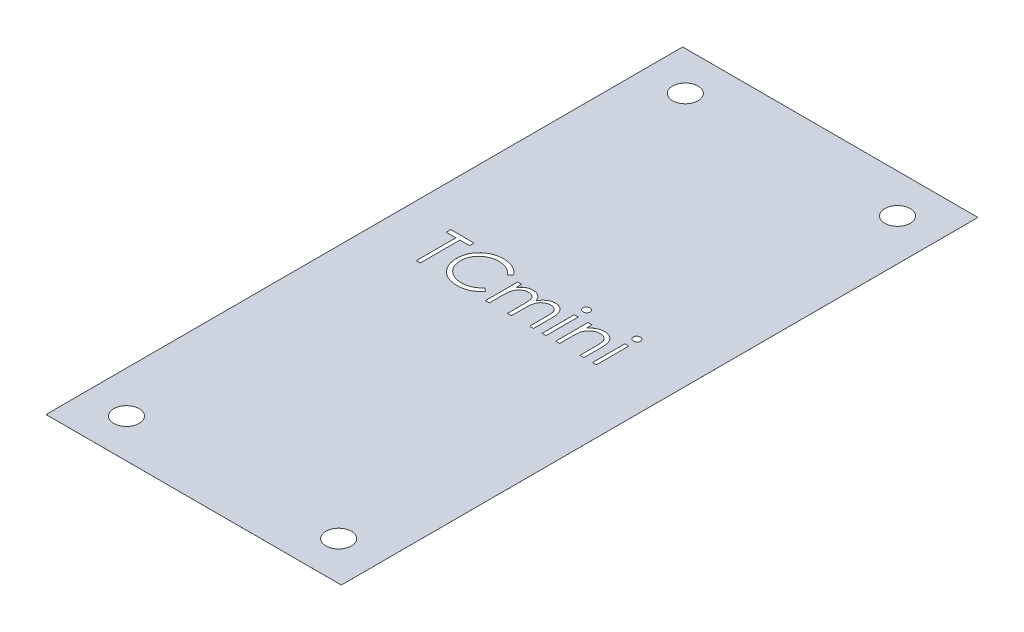
from build123d import *

# Parameters (mm, degrees)
SKETCH2_W           = 42.418
SKETCH2_H           = 91.44
BOSS_EXTRUDE1_DEPTH = 0.00254
SKETCH3_R           = 1.8288
CUT_EXTRUDE1_DEPTH  = 51.399802454
SKETCH5_W           = 0.569871795
SKETCH5_H           = 4.640384615
CUT_EXTRUDE2_DEPTH  = 2.54


with BuildPart() as part:
    # Sketch2 → Boss-Extrude1 (new body)
    with BuildSketch(Plane(origin=(0, 0, 0), x_dir=(1, 0, 0), z_dir=(0, 1, 0))):
        Rectangle(SKETCH2_W, SKETCH2_H)
    extrude(amount=BOSS_EXTRUDE1_DEPTH)

    # Sketch3 → Cut-Extrude1 (cut, through all)
    with BuildSketch(Plane(origin=(0, 0.00254, 0), x_dir=(1, 0, 0), z_dir=(0, 1, 0))):
        with Locations(Location((-15.24, 40.132, 0), (0, 0, 270))):
            Circle(SKETCH3_R)
        with Locations(Location((15.24, 40.132, 0), (0, 0, 270))):
            Circle(SKETCH3_R)
        with Locations(Location((15.24, -40.132, 0), (0, 0, 270))):
            Circle(SKETCH3_R)
        with Locations(Location((-15.24, -40.132, 0), (0, 0, 270))):
            Circle(SKETCH3_R)
    extrude(amount=-CUT_EXTRUDE1_DEPTH, mode=Mode.SUBTRACT)

    # Sketch5 → Cut-Extrude2 (cut)
    with BuildSketch(Plane(origin=(0, 0.00254, 0), x_dir=(1, 0, 0), z_dir=(0, 1, 0))):
        Polygon((-15.139819353, 5.698717949), (-15.139819353, 6.35), (-11.80199884, 6.35), (-11.80199884, 5.698717949), (-13.185973199, 5.698717949), (-13.185973199, 0), (-13.755844994, 0), (-13.755844994, 5.698717949), align=None)
        with BuildLine():
            Line((-4.963537302, 5.184815705), (-5.462175123, 4.803205128))
            add(Edge.make_bspline(
                [(-5.462175123, 4.803205128), (-5.497745806, 4.845597673), (-5.568407602, 4.929811221), (-5.682089298, 5.048065537), (-5.800565136, 5.158855368), (-5.923789827, 5.262708493), (-6.053981373, 5.355993196), (-6.187985964, 5.443570769), (-6.328045275, 5.522070808), (-6.521723422, 5.617253654), (-6.775084518, 5.716578821), (-7.094026584, 5.799860398), (-7.426968148, 5.852875959), (-7.654112364, 5.858617886), (-7.769647078, 5.861538462)],
                knots=[0, 0, 0, 0, 0.757959112, 1.505699292, 2.245454638, 2.979532153, 3.711538275, 4.438200793, 5.171680507, 5.909471876, 7.393775596, 8.890124382, 10.418191784, 12, 12, 12, 12], degree=3))
            add(Edge.make_bspline(
                [(-7.769647078, 5.861538462), (-7.833298206, 5.860805558), (-7.960009722, 5.859346553), (-8.148057666, 5.840098569), (-8.332594202, 5.813045374), (-8.513499291, 5.772903716), (-8.690542658, 5.722153393), (-8.864881731, 5.661510142), (-9.03399239, 5.586480646), (-9.200214051, 5.503552803), (-9.35947062, 5.409885868), (-9.510156206, 5.307717358), (-9.651721234, 5.198190569), (-9.784277687, 5.08089499), (-9.907961079, 4.956358862), (-10.0218752, 4.823254985), (-10.125625873, 4.682008899), (-10.221269619, 4.534483145), (-10.306927006, 4.381107437), (-10.378645502, 4.221314095), (-10.442154795, 4.057839508), (-10.492409135, 3.888836688), (-10.532186473, 3.715494813), (-10.559632376, 3.537348669), (-10.57866146, 3.354770422), (-10.580113209, 3.23101924), (-10.580844994, 3.168639824)],
                knots=[0, 0, 0, 0, 1.054917814, 2.100044995, 3.131103042, 4.146048494, 5.169673617, 6.183595914, 7.203665975, 8.234915748, 9.262203917, 10.264457458, 11.251630812, 12.227803204, 13.197192746, 14.159520551, 15.12972552, 16.100847026, 17.073214652, 18.039054194, 19.002613845, 19.979014051, 20.95965708, 21.949030935, 22.966165397, 24, 24, 24, 24], degree=3))
            add(Edge.make_bspline(
                [(-10.580844994, 3.168639824), (-10.578555694, 3.074784429), (-10.574060957, 2.890511811), (-10.534058979, 2.620599417), (-10.473271171, 2.362026195), (-10.382165767, 2.116408481), (-10.269826918, 1.880717603), (-10.127876094, 1.658941397), (-9.963471805, 1.447728487), (-9.774288215, 1.252070568), (-9.566723378, 1.073338524), (-9.344023595, 0.915948183), (-9.10674353, 0.784748325), (-8.857503073, 0.675571964), (-8.594384266, 0.591649044), (-8.317860267, 0.53256842), (-8.028532505, 0.494029036), (-7.830830879, 0.490339344), (-7.730213985, 0.488461538)],
                knots=[0, 0, 0, 0, 1.029171465, 2.020641659, 2.987623507, 3.938342917, 4.889210282, 5.84687017, 6.821220943, 7.821438502, 8.827599549, 9.822697543, 10.807740252, 11.797342354, 12.80366471, 13.83203677, 14.896651826, 16, 16, 16, 16], degree=3))
            add(Edge.make_bspline(
                [(-7.730213985, 0.488461538), (-7.619356249, 0.491525467), (-7.401161706, 0.497556013), (-7.081179715, 0.548644936), (-6.774863397, 0.631481444), (-6.482196276, 0.747410532), (-6.204003418, 0.898114697), (-5.939849477, 1.080809417), (-5.689511485, 1.297232535), (-5.538977873, 1.462483354), (-5.462175123, 1.546794872)],
                knots=[0, 0, 0, 0, 1.028121516, 2.023589091, 2.998037872, 3.967518031, 4.937445131, 5.927275754, 6.942489185, 8, 8, 8, 8], degree=3))
            Line((-5.462175123, 1.546794872), (-4.963537302, 1.169000401))
            add(Edge.make_bspline(
                [(-4.963537302, 1.169000401), (-5.003665873, 1.117223495), (-5.083730801, 1.013917692), (-5.21337606, 0.868281876), (-5.349950585, 0.731295983), (-5.494468802, 0.604064442), (-5.645268224, 0.48404134), (-5.805056562, 0.374636589), (-5.971733235, 0.274323127), (-6.144733504, 0.182471421), (-6.323873559, 0.100978702), (-6.508938748, 0.03121258), (-6.699131364, -0.028885434), (-6.8944601, -0.078328233), (-7.095330116, -0.116920057), (-7.301016548, -0.14271861), (-7.511963321, -0.160393226), (-7.654278471, -0.162004159), (-7.726397879, -0.162820513)],
                knots=[0, 0, 0, 0, 0.986787822, 1.968848986, 2.935600012, 3.899624008, 4.868462664, 5.837806735, 6.815139263, 7.798259679, 8.787526145, 9.778297419, 10.776456485, 11.791383307, 12.812564526, 13.85620153, 14.913611965, 16, 16, 16, 16], degree=3))
            add(Edge.make_bspline(
                [(-7.726397879, -0.162820513), (-7.794694246, -0.162345183), (-7.929741856, -0.161405279), (-8.129129591, -0.146179489), (-8.323239259, -0.125406395), (-8.51151608, -0.094127871), (-8.694987492, -0.057217426), (-8.871990266, -0.007739575), (-9.044266148, 0.047685342), (-9.211122995, 0.112827246), (-9.372702736, 0.186335178), (-9.528484222, 0.269414149), (-9.678395807, 0.361365532), (-9.823911356, 0.460162479), (-9.962881258, 0.568978441), (-10.096509797, 0.686302192), (-10.225546289, 0.811738298), (-10.305379732, 0.902189246), (-10.345518472, 0.947666266)],
                knots=[0, 0, 0, 0, 1.114604814, 2.203992996, 3.262667896, 4.300477797, 5.318619304, 6.316056647, 7.298880507, 8.271930387, 9.238335007, 10.195173496, 11.151986948, 12.108099108, 13.064862484, 14.031167946, 15.010108607, 16, 16, 16, 16], degree=3))
            add(Edge.make_bspline(
                [(-10.345518472, 0.947666266), (-10.409808854, 1.026662423), (-10.537613447, 1.183701026), (-10.701127188, 1.438219878), (-10.841094895, 1.703955057), (-10.954262637, 1.982302642), (-11.042732167, 2.272638045), (-11.104020907, 2.575107621), (-11.143847389, 2.889428887), (-11.14840177, 3.10321849), (-11.150716789, 3.211889022)],
                knots=[0, 0, 0, 0, 0.994628077, 1.977248131, 2.950237994, 3.925870899, 4.908910175, 5.911660606, 6.938484602, 8, 8, 8, 8], degree=3))
            add(Edge.make_bspline(
                [(-11.150716789, 3.211889022), (-11.147895224, 3.326108202), (-11.14234397, 3.550827308), (-11.09518017, 3.880617195), (-11.019308925, 4.19657759), (-10.911545999, 4.49811867), (-10.774920575, 4.786826464), (-10.606143719, 5.060495507), (-10.407176189, 5.320875986), (-10.17957846, 5.564017035), (-9.929992008, 5.786338432), (-9.662713589, 5.981929687), (-9.378266342, 6.144702895), (-9.079783954, 6.280767361), (-8.76503136, 6.385350887), (-8.434680105, 6.458563097), (-8.089350931, 6.504132722), (-7.853743387, 6.509893457), (-7.73403009, 6.512820513)],
                knots=[0, 0, 0, 0, 1.032925535, 2.032216505, 3.007276963, 3.968222605, 4.92396291, 5.891752235, 6.871517503, 7.883894988, 8.900124299, 9.891468569, 10.874487609, 11.85992873, 12.854644235, 13.869047385, 14.917252991, 16, 16, 16, 16], degree=3))
            add(Edge.make_bspline(
                [(-7.73403009, 6.512820513), (-7.661069549, 6.511945776), (-7.516651503, 6.510214324), (-7.303014548, 6.493330323), (-7.095020612, 6.465184209), (-6.892526402, 6.426873625), (-6.694546798, 6.379326056), (-6.502594933, 6.317385801), (-6.315544458, 6.246562379), (-6.134575067, 6.164994877), (-5.960555041, 6.073433789), (-5.793538577, 5.972894015), (-5.634852334, 5.863500196), (-5.483379709, 5.746182721), (-5.341654583, 5.61845962), (-5.205653043, 5.483843982), (-5.079993658, 5.33845833), (-5.002427148, 5.236123664), (-4.963537302, 5.184815705)],
                knots=[0, 0, 0, 0, 1.096760587, 2.17092713, 3.219439832, 4.250915756, 5.268269357, 6.278326846, 7.281116186, 8.274029601, 9.260640565, 10.235837813, 11.203064059, 12.156899882, 13.114053108, 14.069676657, 15.032185724, 16, 16, 16, 16], degree=3))
        make_face()
        with BuildLine():
            Line((-3.823793712, 4.640384615), (-3.253921917, 4.640384615))
            Line((-3.253921917, 4.640384615), (-3.253921917, 3.833914263))
            add(Edge.make_bspline(
                [(-3.253921917, 3.833914263), (-3.202606751, 3.904467483), (-3.104281973, 4.039654217), (-2.943054289, 4.217799447), (-2.781989057, 4.368980528), (-2.665995635, 4.448342595), (-2.610272078, 4.486468349)],
                knots=[0, 0, 0, 0, 1.134379233, 2.173579362, 3.122582517, 4, 4, 4, 4], degree=3))
            add(Edge.make_bspline(
                [(-2.610272078, 4.486468349), (-2.534317619, 4.522763798), (-2.383735715, 4.594720571), (-2.145303693, 4.667715742), (-1.901328221, 4.71257414), (-1.736576176, 4.718708917), (-1.653701565, 4.721794872)],
                knots=[0, 0, 0, 0, 1.014936303, 2.012140481, 3.000054389, 4, 4, 4, 4], degree=3))
            add(Edge.make_bspline(
                [(-1.653701565, 4.721794872), (-1.597652843, 4.719898416), (-1.486735435, 4.716145431), (-1.322390014, 4.691725081), (-1.16298939, 4.649513596), (-1.009475365, 4.590717451), (-0.864839276, 4.519512748), (-0.732234588, 4.435965421), (-0.613173525, 4.342172155), (-0.50771626, 4.23389752), (-0.412885314, 4.108101119), (-0.32565655, 3.961390268), (-0.245056522, 3.790470654), (-0.200386433, 3.666434216), (-0.176868632, 3.601131811)],
                knots=[0, 0, 0, 0, 1.009824226, 1.998387844, 2.986035974, 3.974953746, 4.955485308, 5.885931332, 6.793869504, 7.679848016, 8.601185859, 9.625726857, 10.749998409, 12, 12, 12, 12], degree=3))
            add(Edge.make_bspline(
                [(-0.176868632, 3.601131811), (-0.151992505, 3.645988972), (-0.103039779, 3.734261564), (-0.020842409, 3.859190126), (0.065277736, 3.976042448), (0.156054602, 4.084911247), (0.251167781, 4.1852589), (0.351064893, 4.277417179), (0.455177282, 4.361781852), (0.599943203, 4.460339585), (0.788288933, 4.565026014), (1.02575737, 4.655791905), (1.272772681, 4.711882595), (1.440444791, 4.718468947), (1.525114541, 4.721794872)],
                knots=[0, 0, 0, 0, 0.86119277, 1.694706429, 2.50939023, 3.298075842, 4.073795165, 4.829715201, 5.57930267, 6.321991688, 7.768977793, 9.186738141, 10.579381044, 12, 12, 12, 12], degree=3))
            add(Edge.make_bspline(
                [(1.525114541, 4.721794872), (1.602913766, 4.718860771), (1.755174404, 4.713118451), (1.976838872, 4.66802715), (2.183561862, 4.590597704), (2.374927414, 4.484945249), (2.547574504, 4.352177302), (2.697645522, 4.194209554), (2.824228896, 4.012159367), (2.906921571, 3.84090533), (2.963010693, 3.689711226), (2.997593218, 3.560885526), (3.028145236, 3.41909628), (3.05351121, 3.264173948), (3.072050583, 3.095571273), (3.085786024, 2.91356417), (3.095082557, 2.718011182), (3.09573946, 2.583090917), (3.096078083, 2.513541667)],
                knots=[0, 0, 0, 0, 1.209669288, 2.367440248, 3.500751976, 4.631527125, 5.755587489, 6.87532382, 8.007944318, 9.190864318, 9.82315674, 10.514484317, 11.263564316, 12.079023757, 12.955305781, 13.901327259, 14.918167583, 16, 16, 16, 16], degree=3))
            Line((3.096078083, 2.513541667), (3.096078083, 0))
            Line((3.096078083, 0), (2.526206288, 0))
            Line((2.526206288, 0), (2.526206288, 2.516085737))
            add(Edge.make_bspline(
                [(2.526206288, 2.516085737), (2.526064986, 2.575450207), (2.525793425, 2.68953969), (2.520906408, 2.853283423), (2.511698338, 3.002541728), (2.500931207, 3.137111088), (2.485974582, 3.257305318), (2.46665982, 3.362882992), (2.446198886, 3.454674621), (2.412206445, 3.556430736), (2.357872414, 3.668680975), (2.275109271, 3.789736606), (2.170842078, 3.895111772), (2.050445794, 3.986585004), (1.91337933, 4.060959181), (1.762313333, 4.114074227), (1.598185696, 4.146954307), (1.484570066, 4.150230935), (1.425895791, 4.151923077)],
                knots=[0, 0, 0, 0, 1.253487763, 2.409012846, 3.458416907, 4.410876679, 5.259312806, 6.014470957, 6.676830364, 7.243083969, 8.276244668, 9.299465089, 10.325150304, 11.392391894, 12.482080715, 13.603491619, 14.762376348, 16, 16, 16, 16], degree=3))
            add(Edge.make_bspline(
                [(1.425895791, 4.151923077), (1.353923159, 4.149353763), (1.211677878, 4.144275821), (1.004041067, 4.092434652), (0.804522223, 4.014274768), (0.619074767, 3.901004453), (0.44848149, 3.765280708), (0.301706542, 3.603900727), (0.180453862, 3.421329288), (0.09835022, 3.252334556), (0.046481059, 3.10053428), (0.01223294, 2.967914762), (-0.014406927, 2.81718106), (-0.039390601, 2.649346041), (-0.055696908, 2.463254428), (-0.070516669, 2.259767044), (-0.077448806, 2.03827186), (-0.078418467, 1.884734868), (-0.078921917, 1.805018029)],
                knots=[0, 0, 0, 0, 1.090531906, 2.155305635, 3.229839962, 4.33261226, 5.44038871, 6.529323825, 7.629011124, 8.757537029, 9.370236727, 10.061839251, 10.834451254, 11.692844982, 12.636905849, 13.66920014, 14.789842145, 16, 16, 16, 16], degree=3))
            Line((-0.078921917, 1.805018029), (-0.078921917, 0))
            Line((-0.078921917, 0), (-0.648793712, 0))
            Line((-0.648793712, 0), (-0.648793712, 2.359625401))
            add(Edge.make_bspline(
                [(-0.648793712, 2.359625401), (-0.648937823, 2.426197565), (-0.649215077, 2.554275717), (-0.654070681, 2.737942528), (-0.663299266, 2.905003916), (-0.673968261, 3.055265715), (-0.689317442, 3.18845484), (-0.706752296, 3.305285329), (-0.727341918, 3.405464292), (-0.761432137, 3.515343576), (-0.813528387, 3.636394393), (-0.897327091, 3.765464532), (-1.001843701, 3.878436652), (-1.124436576, 3.974881809), (-1.262332599, 4.054604211), (-1.414702484, 4.112044047), (-1.580174254, 4.145470972), (-1.694252378, 4.149731816), (-1.752920315, 4.151923077)],
                knots=[0, 0, 0, 0, 1.320475261, 2.540461679, 3.643808994, 4.639130445, 5.527981419, 6.302341397, 6.981980563, 7.553956391, 8.582137848, 9.585246428, 10.591171744, 11.620968678, 12.668337649, 13.738356861, 14.836885341, 16, 16, 16, 16], degree=3))
            add(Edge.make_bspline(
                [(-1.752920315, 4.151923077), (-1.821892584, 4.149146385), (-1.959351868, 4.143612537), (-2.161285441, 4.09380264), (-2.356295181, 4.015780962), (-2.541270135, 3.907541004), (-2.711221804, 3.773466962), (-2.860008232, 3.615778508), (-2.985089671, 3.436438119), (-3.06806025, 3.269225353), (-3.12157891, 3.121228126), (-3.157130445, 2.995405692), (-3.187682338, 2.855705242), (-3.210386349, 2.701695769), (-3.232303674, 2.534380355), (-3.242881521, 2.352925495), (-3.253171355, 2.15748685), (-3.253665593, 2.022553804), (-3.253921917, 1.952574119)],
                knots=[0, 0, 0, 0, 1.098833095, 2.189935336, 3.297829714, 4.440610912, 5.596351641, 6.740013378, 7.886572111, 9.072425424, 9.705826452, 10.395263256, 11.156850408, 11.985370555, 12.878090359, 13.847760091, 14.883794034, 16, 16, 16, 16], degree=3))
            Line((-3.253921917, 1.952574119), (-3.253921917, 0))
            Line((-3.253921917, 0), (-3.823793712, 0))
            Line((-3.823793712, 0), (-3.823793712, 4.640384615))
        make_face()
        with BuildLine():
            add(Edge.make_bspline(
                [(4.599623756, 6.594230769), (4.634986571, 6.592590378), (4.704233757, 6.589378178), (4.804370114, 6.561870927), (4.895550693, 6.515244355), (4.976427437, 6.452688362), (5.045827288, 6.379120086), (5.094415148, 6.293375187), (5.125643353, 6.200740228), (5.129414446, 6.13612428), (5.131334493, 6.10322516)],
                knots=[0, 0, 0, 0, 1.055194115, 2.066272739, 3.074728998, 4.095836921, 5.109056067, 6.073838105, 7.019297344, 8, 8, 8, 8], degree=3))
            add(Edge.make_bspline(
                [(5.131334493, 6.10322516), (5.129371146, 6.071180061), (5.125489841, 6.007830692), (5.094439269, 5.916801678), (5.045413209, 5.832248193), (4.976471938, 5.758822761), (4.895538901, 5.696301351), (4.804373246, 5.64966561), (4.704232933, 5.622160789), (4.634986293, 5.618948254), (4.599623756, 5.617307692)],
                knots=[0, 0, 0, 0, 0.96129708, 1.900370562, 2.859976407, 3.87933698, 4.906634145, 5.921202961, 6.938410037, 8, 8, 8, 8], degree=3))
            add(Edge.make_bspline(
                [(4.599623756, 5.617307692), (4.564665599, 5.618885613), (4.496624115, 5.62195683), (4.39798713, 5.650205291), (4.307584013, 5.696317309), (4.226549536, 5.758413388), (4.159003328, 5.83269913), (4.109839224, 5.916750078), (4.078860364, 6.00784383), (4.074969395, 6.071184474), (4.07300116, 6.10322516)],
                knots=[0, 0, 0, 0, 1.054934014, 2.053291228, 3.073705704, 4.106921865, 5.123545215, 6.088680038, 7.033164197, 8, 8, 8, 8], degree=3))
            add(Edge.make_bspline(
                [(4.07300116, 6.10322516), (4.074926274, 6.136119702), (4.07870732, 6.200726657), (4.109862445, 6.293427645), (4.15859381, 6.378665512), (4.226594261, 6.45309749), (4.307572111, 6.515228493), (4.397990205, 6.561331274), (4.496623303, 6.589582132), (4.564665324, 6.592653018), (4.599623756, 6.594230769)],
                knots=[0, 0, 0, 0, 0.98631895, 1.937192651, 2.907499808, 3.917963147, 4.944918757, 5.95915025, 6.951458133, 8, 8, 8, 8], degree=3))
        make_face()
        with Locations((4.602167827, 2.320192308)):
            Rectangle(SKETCH5_W, SKETCH5_H)
        with BuildLine():
            Line((6.271078083, 4.640384615), (6.840949877, 4.640384615))
            Line((6.840949877, 4.640384615), (6.840949877, 3.803385417))
            add(Edge.make_bspline(
                [(6.840949877, 3.803385417), (6.90179673, 3.879300071), (7.01987217, 4.026615106), (7.216512317, 4.22023672), (7.424327679, 4.379794485), (7.6420456, 4.506982797), (7.869961632, 4.602861676), (8.106686493, 4.67210558), (8.35363746, 4.713625197), (8.521575796, 4.719050329), (8.606534813, 4.721794872)],
                knots=[0, 0, 0, 0, 1.12780773, 2.188550248, 3.19190651, 4.159438251, 5.104880172, 6.052711206, 7.014878035, 8, 8, 8, 8], degree=3))
            add(Edge.make_bspline(
                [(8.606534813, 4.721794872), (8.692406107, 4.718628589), (8.860476941, 4.712431409), (9.105184281, 4.663415412), (9.33373601, 4.579694735), (9.545317204, 4.465009979), (9.736048005, 4.322395377), (9.903551664, 4.156247116), (10.042096413, 3.965137365), (10.134983057, 3.787839638), (10.196171018, 3.630561397), (10.234692545, 3.495856579), (10.267405897, 3.345782219), (10.295766354, 3.180791822), (10.314956257, 2.999729391), (10.330091557, 2.80333715), (10.340938617, 2.591678713), (10.341368978, 2.445290118), (10.341590903, 2.369801683)],
                knots=[0, 0, 0, 0, 1.235846778, 2.418850247, 3.575807741, 4.728682307, 5.871620074, 6.994088408, 8.11269785, 9.256955736, 9.865816715, 10.540099792, 11.271859618, 12.076849838, 12.949306005, 13.892391288, 14.913166135, 16, 16, 16, 16], degree=3))
            Line((10.341590903, 2.369801683), (10.341590903, 0))
            Line((10.341590903, 0), (9.771719108, 0))
            Line((9.771719108, 0), (9.771719108, 2.1828125))
            add(Edge.make_bspline(
                [(9.771719108, 2.1828125), (9.771368574, 2.245990364), (9.770698061, 2.366838867), (9.768583245, 2.539865523), (9.763485453, 2.696776887), (9.756322085, 2.837197825), (9.745837272, 2.9609935), (9.734910498, 3.068416045), (9.721548326, 3.159329072), (9.709641327, 3.21405715), (9.70430124, 3.238601763)],
                knots=[0, 0, 0, 0, 1.430800155, 2.736877192, 3.918605307, 4.986035426, 5.920637409, 6.731861385, 7.431261377, 8, 8, 8, 8], degree=3))
            add(Edge.make_bspline(
                [(9.70430124, 3.238601763), (9.68502349, 3.310649198), (9.647919785, 3.449318221), (9.556236702, 3.637413118), (9.440459545, 3.79742983), (9.29913059, 3.928379025), (9.133614981, 4.030288971), (8.944372022, 4.100998861), (8.733227917, 4.145224378), (8.58472068, 4.149627889), (8.507316063, 4.151923077)],
                knots=[0, 0, 0, 0, 1.084156227, 2.086665306, 3.027808233, 3.945421172, 4.874247719, 5.839848303, 6.874090471, 8, 8, 8, 8], degree=3))
            add(Edge.make_bspline(
                [(8.507316063, 4.151923077), (8.461473266, 4.151059468), (8.370751554, 4.14935041), (8.23622232, 4.132203055), (8.10573132, 4.104156999), (7.977968941, 4.066295329), (7.855490515, 4.014293783), (7.734361015, 3.955276211), (7.6191416, 3.88171017), (7.507375437, 3.799721471), (7.403393629, 3.70886348), (7.306640786, 3.612988441), (7.220393235, 3.510888417), (7.142254353, 3.404208512), (7.074802361, 3.291483606), (7.015923187, 3.173801221), (6.965965569, 3.051006465), (6.941141255, 2.965780283), (6.92872031, 2.923137019)],
                knots=[0, 0, 0, 0, 1.023777757, 2.026029729, 3.023749952, 4.003683103, 4.997618607, 5.993177895, 7.010360494, 8.046726602, 9.087585522, 10.09234134, 11.086953743, 12.070360549, 13.043493632, 14.017870808, 15.008233677, 16, 16, 16, 16], degree=3))
            add(Edge.make_bspline(
                [(6.92872031, 2.923137019), (6.921572662, 2.891831151), (6.906012606, 2.823679913), (6.889206551, 2.711839324), (6.873952807, 2.582462655), (6.861185754, 2.435700879), (6.853374498, 2.271040163), (6.844857521, 2.089183715), (6.841756796, 1.889406386), (6.841226382, 1.750320172), (6.840949877, 1.677814503)],
                knots=[0, 0, 0, 0, 0.615963638, 1.340920617, 2.168419149, 3.115676021, 4.16674242, 5.331190069, 6.6087489, 8, 8, 8, 8], degree=3))
            Line((6.840949877, 1.677814503), (6.840949877, 0))
            Line((6.840949877, 0), (6.271078083, 0))
            Line((6.271078083, 0), (6.271078083, 4.640384615))
        make_face()
        with BuildLine():
            add(Edge.make_bspline(
                [(11.845136576, 6.594230769), (11.880499392, 6.592590378), (11.949746577, 6.589378178), (12.049882934, 6.561870927), (12.141063513, 6.515244355), (12.221940257, 6.452688362), (12.291340109, 6.379120086), (12.339927969, 6.293375187), (12.371156173, 6.200740228), (12.374927267, 6.13612428), (12.376847313, 6.10322516)],
                knots=[0, 0, 0, 0, 1.055194115, 2.066272739, 3.074728998, 4.095836921, 5.109056067, 6.073838105, 7.019297344, 8, 8, 8, 8], degree=3))
            add(Edge.make_bspline(
                [(12.376847313, 6.10322516), (12.374883966, 6.071180061), (12.371002661, 6.007830692), (12.33995209, 5.916801678), (12.29092603, 5.832248193), (12.221984759, 5.758822761), (12.141051721, 5.696301351), (12.049886067, 5.64966561), (11.949745753, 5.622160789), (11.880499113, 5.618948254), (11.845136576, 5.617307692)],
                knots=[0, 0, 0, 0, 0.96129708, 1.900370562, 2.859976407, 3.87933698, 4.906634145, 5.921202961, 6.938410037, 8, 8, 8, 8], degree=3))
            add(Edge.make_bspline(
                [(11.845136576, 5.617307692), (11.81017842, 5.618885613), (11.742136936, 5.62195683), (11.64349995, 5.650205291), (11.553096834, 5.696317309), (11.472062356, 5.758413388), (11.404516149, 5.83269913), (11.355352044, 5.916750078), (11.324373185, 6.00784383), (11.320482216, 6.071184474), (11.31851398, 6.10322516)],
                knots=[0, 0, 0, 0, 1.054934014, 2.053291228, 3.073705704, 4.106921865, 5.123545215, 6.088680038, 7.033164197, 8, 8, 8, 8], degree=3))
            add(Edge.make_bspline(
                [(11.31851398, 6.10322516), (11.320439094, 6.136119702), (11.32422014, 6.200726657), (11.355375265, 6.293427645), (11.404106631, 6.378665512), (11.472107082, 6.45309749), (11.553084931, 6.515228493), (11.643503026, 6.561331274), (11.742136123, 6.589582132), (11.810178144, 6.592653018), (11.845136576, 6.594230769)],
                knots=[0, 0, 0, 0, 0.98631895, 1.937192651, 2.907499808, 3.917963147, 4.944918757, 5.95915025, 6.951458133, 8, 8, 8, 8], degree=3))
        make_face()
        with Locations((11.847680647, 2.320192308)):
            Rectangle(SKETCH5_W, SKETCH5_H)
    extrude(amount=-CUT_EXTRUDE2_DEPTH, mode=Mode.SUBTRACT)


solid = part.part
